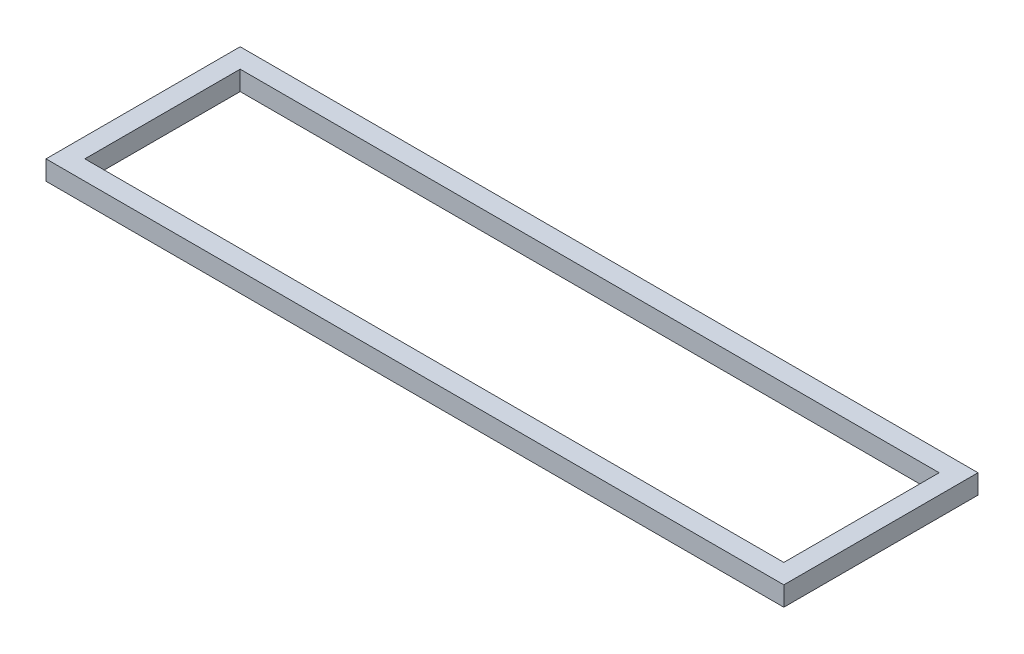
from build123d import *

# Parameters (mm, degrees)
SKETCH1_W           = 120.65
SKETCH1_H           = 31.75
BOSS_EXTRUDE1_DEPTH = 3.175
SKETCH4_W           = 114.3
SKETCH4_H           = 25.4
CUT_EXTRUDE1_DEPTH  = 5.08


with BuildPart() as part:
    # Sketch1 → Boss-Extrude1 (new body)
    with BuildSketch(Plane(origin=(0, 0, 0), x_dir=(1, 0, 0), z_dir=(0, 1, 0))):
        with Locations((60.325, 15.875)):
            Rectangle(SKETCH1_W, SKETCH1_H)
    extrude(amount=BOSS_EXTRUDE1_DEPTH)

    # Sketch4 → Cut-Extrude1 (cut)
    with BuildSketch(Plane(origin=(0, 3.175, 0), x_dir=(1, 0, 0), z_dir=(0, 1, 0))):
        with Locations((60.325, 15.875)):
            Rectangle(SKETCH4_W, SKETCH4_H)
    extrude(amount=-CUT_EXTRUDE1_DEPTH, mode=Mode.SUBTRACT)


solid = part.part
